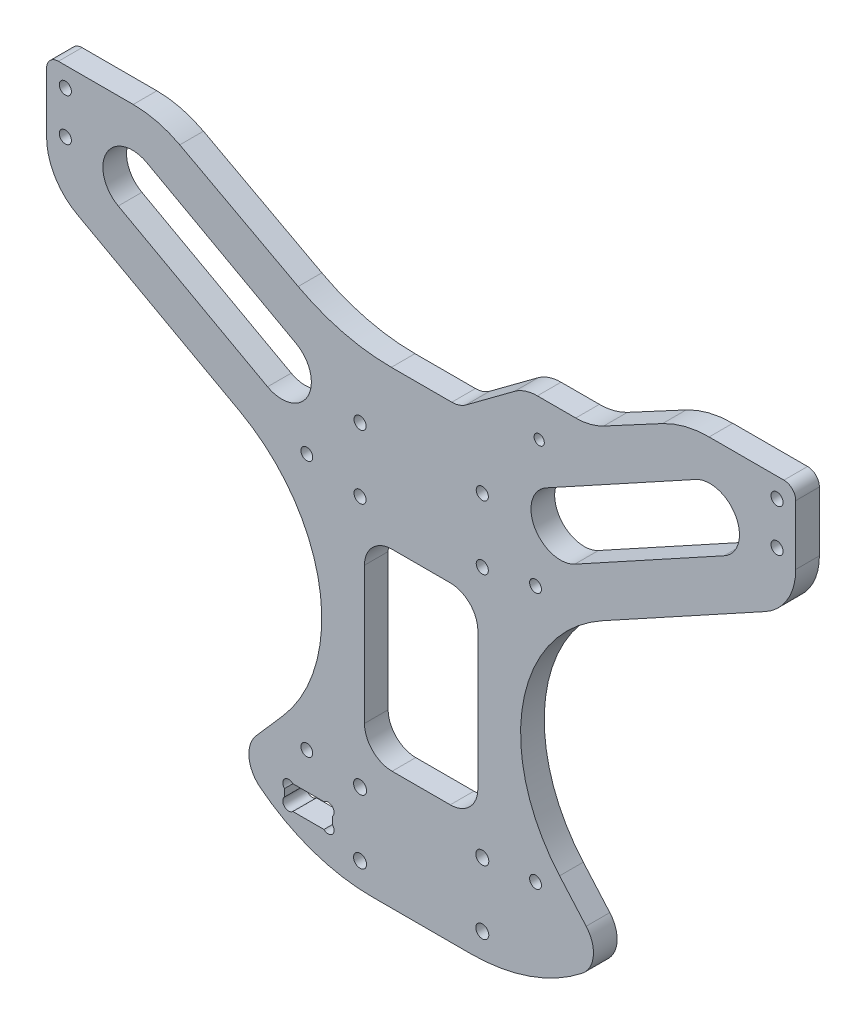
from build123d import *

# Parameters (mm, degrees)
SKETCH1_R                   = 2.6
BOSS_EXTRUDE1_DEPTH         = 12
CUT_EXTRUDE1_DEPTH          = 345.8191555
SKETCH3_W                   = 57.5
SKETCH3_H                   = 97.5
CUT_EXTRUDE2_DEPTH          = 345.8191555
CUT_EXTRUDE3_DEPTH          = 345.8191555
CUT_EXTRUDE4_DEPTH          = 345.8191555
CUT_EXTRUDE5_DEPTH          = 345.8191555
SKETCH7_W                   = 10
SKETCH7_H                   = 11.5
CUT_EXTRUDE6_DEPTH          = 7
SKETCH8_W                   = 10
SKETCH8_H                   = 11.5
CUT_EXTRUDE7_DEPTH          = 7
SKETCH9_W                   = 10
SKETCH9_H                   = 11.5
CUT_EXTRUDE8_DEPTH          = 7
SKETCH10_W                  = 10
SKETCH10_H                  = 11.5
CUT_EXTRUDE9_DEPTH          = 7
SKETCH11_W                  = 10
SKETCH11_H                  = 11.5
CUT_EXTRUDE10_DEPTH         = 7
SKETCH12_W                  = 10
SKETCH12_H                  = 11.5
CUT_EXTRUDE11_DEPTH         = 7
SKETCH13_W                  = 10
SKETCH13_H                  = 11.5
CUT_EXTRUDE12_DEPTH         = 7
SKETCH14_W                  = 10
SKETCH14_H                  = 11.5
CUT_EXTRUDE13_DEPTH         = 7
SKETCH15_W                  = 10
SKETCH15_H                  = 11.5
CUT_EXTRUDE14_DEPTH         = 7
SKETCH16_W                  = 10
SKETCH16_H                  = 11.5
CUT_EXTRUDE15_DEPTH         = 7
SKETCH17_W                  = 10
SKETCH17_H                  = 11.5
CUT_EXTRUDE16_DEPTH         = 7
SKETCH18_W                  = 10
SKETCH18_H                  = 11.5
CUT_EXTRUDE17_DEPTH         = 7
F_12_CLEARANCE_HOLE1_D      = 6
F_12_CLEARANCE_HOLE2_D      = 6.15
F_12_CLEARANCE_HOLE2_DEPTH  = 12
F_1_4_CLEARANCE_HOLE1_D     = 6.6
F_1_4_CLEARANCE_HOLE1_DEPTH = 12
FILLET1_R                   = 3
FILLET2_R                   = 6
FILLET3_R                   = 12
FILLET4_R                   = 14
FILLET5_R                   = 15
FILLET6_R                   = 19.5
FILLET7_R                   = 30
FILLET8_R                   = 50
FILLET9_R                   = 100
CUT_EXTRUDE18_DEPTH         = 5


with BuildPart() as part:
    # Sketch1 → Boss-Extrude1 (new body)
    with BuildSketch(Plane(origin=(0, 0, 0), x_dir=(-1, 0, 0), z_dir=(0, 0, -1))):
        with BuildLine():
            Line((190, 233.5), (190, 287.5))
            Line((190, 287.5), (-190, 287.5))
            Line((-190, 287.5), (-190, 233.5))
            Line((-190, 233.5), (-91.996080671, 179.733208693))
            ThreePointArc((-91.996080671, 179.733208693), (-51.65153849, 123.480878435), (-70.214934772, 56.791995839))
            Line((-70.214934772, 56.791995839), (-93.161541916, 30.540237585))
            ThreePointArc((-93.161541916, 30.540237585), (-62.345354156, 7.98402536), (-25, 0))
            Line((-25, 0), (25, 0))
            ThreePointArc((25, 0), (62.345354156, 7.98402536), (93.161541916, 30.540237585))
            Line((93.161541916, 30.540237585), (70.214934772, 56.791995839))
            ThreePointArc((70.214934772, 56.791995839), (51.65153849, 123.480878435), (91.996080671, 179.733208693))
            Line((91.996080671, 179.733208693), (190, 233.5))
        make_face()
        with Locations((-59.857743265, 243.186048556)):
            Circle(SKETCH1_R, mode=Mode.SUBTRACT)
    extrude(amount=-BOSS_EXTRUDE1_DEPTH)

    # Sketch2 → Cut-Extrude1 (cut, through all)
    with BuildSketch(Plane.XY.offset(12)):
        Polygon((133.5, 287.5), (-133.5, 287.5), (-40.250394076, 237.5), (19.5, 237.5), (52.5, 262), (85.942700979, 262), align=None)
    extrude(amount=-CUT_EXTRUDE1_DEPTH, mode=Mode.SUBTRACT)

    # Sketch3 → Cut-Extrude2 (cut, through all)
    with BuildSketch(Plane(origin=(0, 0, 0), x_dir=(-1, 0, 0), z_dir=(0, 0, -1))):
        with Locations((0, 109)):
            Rectangle(SKETCH3_W, SKETCH3_H)
    extrude(amount=-CUT_EXTRUDE2_DEPTH, mode=Mode.SUBTRACT)

    # Sketch4 → Cut-Extrude3 (cut, through all)
    with BuildSketch(Plane(origin=(0, 0, 0), x_dir=(-1, 0, 0), z_dir=(0, 0, -1))):
        with BuildLine():
            Line((-153.664023227, 239.106528299), (-77.914831534, 197.549098664))
            ThreePointArc((-77.914831534, 197.549098664), (-57.549098664, 203.485168466), (-63.485168466, 223.850901336))
            Line((-63.485168466, 223.850901336), (-139.234360159, 265.40833097))
            ThreePointArc((-139.234360159, 265.40833097), (-159.600093029, 259.472261168), (-153.664023227, 239.106528299))
        make_face()
    extrude(amount=-CUT_EXTRUDE3_DEPTH, mode=Mode.SUBTRACT)

    # Sketch5 → Cut-Extrude4 (cut, through all)
    with BuildSketch(Plane.XY.offset(12)):
        with BuildLine():
            Line((-63.485168466, 223.850901336), (-139.234360159, 265.40833097))
            ThreePointArc((-139.234360159, 265.40833097), (-159.600093029, 259.472261168), (-153.664023227, 239.106528299))
            Line((-153.664023227, 239.106528299), (-77.914831534, 197.549098664))
            ThreePointArc((-77.914831534, 197.549098664), (-57.549098664, 203.485168466), (-63.485168466, 223.850901336))
        make_face()
    extrude(amount=-CUT_EXTRUDE4_DEPTH, mode=Mode.SUBTRACT)

    # Sketch6 → Cut-Extrude5 (cut, through all)
    with BuildSketch(Plane.XY.offset(12)):
        with BuildLine():
            Line((-65.082359313, 17.4), (-49.317640687, 17.4))
            ThreePointArc((-49.317640687, 17.4), (-45.074999992, 17.400000008), (-45.075000016, 21.642640703))
            Line((-45.075000016, 21.642640703), (-45.075000016, 25.357359313))
            ThreePointArc((-45.075000016, 25.357359313), (-45.075000008, 29.599999992), (-49.317640687, 29.6))
            Line((-49.317640687, 29.6), (-65.082359313, 29.6))
            ThreePointArc((-65.082359313, 29.6), (-69.325, 29.6), (-69.325, 25.357359313))
            Line((-69.325, 25.357359313), (-69.325, 21.642640687))
            ThreePointArc((-69.325, 21.642640687), (-69.325, 17.4), (-65.082359313, 17.4))
        make_face()
    extrude(amount=-CUT_EXTRUDE5_DEPTH, mode=Mode.SUBTRACT)

    # Sketch7 → Cut-Extrude6 (cut)
    with BuildSketch(Plane(origin=(0, 0, 0), x_dir=(-1, 0, 0), z_dir=(0, 0, -1))):
        with Locations((31, 45.2)):
            Rectangle(SKETCH7_W, SKETCH7_H)
    extrude(amount=-CUT_EXTRUDE6_DEPTH, mode=Mode.SUBTRACT)

    # Sketch8 → Cut-Extrude7 (cut)
    with BuildSketch(Plane(origin=(0, 0, 0), x_dir=(-1, 0, 0), z_dir=(0, 0, -1))):
        with Locations((-31, 45.2)):
            Rectangle(SKETCH8_W, SKETCH8_H)
    extrude(amount=-CUT_EXTRUDE7_DEPTH, mode=Mode.SUBTRACT)

    # Sketch9 → Cut-Extrude8 (cut)
    with BuildSketch(Plane(origin=(0, 0, 0), x_dir=(-1, 0, 0), z_dir=(0, 0, -1))):
        with Locations((-31, 12.8)):
            Rectangle(SKETCH9_W, SKETCH9_H)
    extrude(amount=-CUT_EXTRUDE8_DEPTH, mode=Mode.SUBTRACT)

    # Sketch10 → Cut-Extrude9 (cut)
    with BuildSketch(Plane(origin=(0, 0, 0), x_dir=(-1, 0, 0), z_dir=(0, 0, -1))):
        with Locations((31, 12.8)):
            Rectangle(SKETCH10_W, SKETCH10_H)
    extrude(amount=-CUT_EXTRUDE9_DEPTH, mode=Mode.SUBTRACT)

    # Sketch11 → Cut-Extrude10 (cut)
    with BuildSketch(Plane(origin=(0, 0, 0), x_dir=(-1, 0, 0), z_dir=(0, 0, -1))):
        with Locations((-31, 172.8)):
            Rectangle(SKETCH11_W, SKETCH11_H)
    extrude(amount=-CUT_EXTRUDE10_DEPTH, mode=Mode.SUBTRACT)

    # Sketch12 → Cut-Extrude11 (cut)
    with BuildSketch(Plane(origin=(0, 0, 0), x_dir=(-1, 0, 0), z_dir=(0, 0, -1))):
        with Locations((31, 205.2)):
            Rectangle(SKETCH12_W, SKETCH12_H)
    extrude(amount=-CUT_EXTRUDE11_DEPTH, mode=Mode.SUBTRACT)

    # Sketch13 → Cut-Extrude12 (cut)
    with BuildSketch(Plane(origin=(0, 0, 0), x_dir=(-1, 0, 0), z_dir=(0, 0, -1))):
        with Locations((31, 172.8)):
            Rectangle(SKETCH13_W, SKETCH13_H)
    extrude(amount=-CUT_EXTRUDE12_DEPTH, mode=Mode.SUBTRACT)

    # Sketch14 → Cut-Extrude13 (cut)
    with BuildSketch(Plane(origin=(0, 0, 0), x_dir=(-1, 0, 0), z_dir=(0, 0, -1))):
        with Locations((-31, 205.2)):
            Rectangle(SKETCH14_W, SKETCH14_H)
    extrude(amount=-CUT_EXTRUDE13_DEPTH, mode=Mode.SUBTRACT)

    # Sketch15 → Cut-Extrude14 (cut)
    with BuildSketch(Plane(origin=(0, 0, 0), x_dir=(-1, 0, 0), z_dir=(0, 0, -1))):
        with Locations((-180.5, 256)):
            Rectangle(SKETCH15_W, SKETCH15_H)
    extrude(amount=-CUT_EXTRUDE14_DEPTH, mode=Mode.SUBTRACT)

    # Sketch16 → Cut-Extrude15 (cut)
    with BuildSketch(Plane(origin=(0, 0, 0), x_dir=(-1, 0, 0), z_dir=(0, 0, -1))):
        with Locations((180.5, 277.5)):
            Rectangle(SKETCH16_W, SKETCH16_H)
    extrude(amount=-CUT_EXTRUDE15_DEPTH, mode=Mode.SUBTRACT)

    # Sketch17 → Cut-Extrude16 (cut)
    with BuildSketch(Plane(origin=(0, 0, 0), x_dir=(-1, 0, 0), z_dir=(0, 0, -1))):
        with Locations((180.5, 256)):
            Rectangle(SKETCH17_W, SKETCH17_H)
    extrude(amount=-CUT_EXTRUDE16_DEPTH, mode=Mode.SUBTRACT)

    # Sketch18 → Cut-Extrude17 (cut)
    with BuildSketch(Plane(origin=(0, 0, 0), x_dir=(-1, 0, 0), z_dir=(0, 0, -1))):
        with Locations((-180.5, 277.5)):
            Rectangle(SKETCH18_W, SKETCH18_H)
    extrude(amount=-CUT_EXTRUDE17_DEPTH, mode=Mode.SUBTRACT)

    # #12 Clearance Hole1 (through all)
    with Locations(Plane.XY.offset(12)):
        with Locations((58, 48), (-58, 178), (58, 178), (-58, 48)):
            Hole(F_12_CLEARANCE_HOLE1_D / 2)

    # #12 Clearance Hole2
    with Locations(Plane.XY.offset(12)):
        with Locations((31, 172.8), (-31, 205.2), (-31, 172.8), (31, 205.2), (180.5, 256), (-180.5, 277.5), (-180.5, 256), (180.5, 277.5)):
            Hole(F_12_CLEARANCE_HOLE2_D / 2, depth=F_12_CLEARANCE_HOLE2_DEPTH)

    # 1/4 Clearance Hole1
    with Locations(Plane.XY.offset(12)):
        with Locations((-31, 45.2), (31, 45.2), (31, 12.8), (-31, 12.8)):
            Hole(F_1_4_CLEARANCE_HOLE1_D / 2, depth=F_1_4_CLEARANCE_HOLE1_DEPTH)

    # Fillet1
    fillet1_edges = [part.edges().sort_by_distance(p)[0] for p in [
        (-26, 39.45, 3.5),
        (-26, 50.95, 3.5),
        (-36, 50.95, 3.5),
        (-36, 39.45, 3.5),
        (36, 50.95, 3.5),
        (26, 50.95, 3.5),
        (26, 39.45, 3.5),
        (36, 39.45, 3.5),
        (36, 7.05, 3.5),
        (36, 18.55, 3.5),
        (26, 18.55, 3.5),
        (26, 7.05, 3.5),
        (-26, 7.05, 3.5),
        (-26, 18.55, 3.5),
        (-36, 18.55, 3.5),
        (-36, 7.05, 3.5),
        (26, 178.55, 3.5),
        (26, 167.05, 3.5),
        (36, 167.05, 3.5),
        (36, 178.55, 3.5),
        (-26, 210.95, 3.5),
        (-36, 210.95, 3.5),
        (-36, 199.45, 3.5),
        (-26, 199.45, 3.5),
        (-26, 167.05, 3.5),
        (-26, 178.55, 3.5),
        (-36, 178.55, 3.5),
        (-36, 167.05, 3.5),
        (26, 210.95, 3.5),
        (26, 199.45, 3.5),
        (36, 199.45, 3.5),
        (36, 210.95, 3.5),
        (175.5, 261.75, 3.5),
        (175.5, 250.25, 3.5),
        (185.5, 250.25, 3.5),
        (185.5, 261.75, 3.5),
        (-175.5, 271.75, 3.5),
        (-175.5, 283.25, 3.5),
        (-185.5, 283.25, 3.5),
        (-185.5, 271.75, 3.5),
        (-175.5, 261.75, 3.5),
        (-185.5, 261.75, 3.5),
        (-185.5, 250.25, 3.5),
        (-175.5, 250.25, 3.5),
        (175.5, 283.25, 3.5),
        (175.5, 271.75, 3.5),
        (185.5, 271.75, 3.5),
        (185.5, 283.25, 3.5),
    ]]
    fillet(fillet1_edges, radius=FILLET1_R)

    # Fillet2
    fillet2_edges = [part.edges().sort_by_distance(p)[0] for p in [
        (190, 287.5, 6),
        (-190, 287.5, 6),
    ]]
    fillet(fillet2_edges, radius=FILLET2_R)

    # Fillet3
    fillet3_edges = [part.edges().sort_by_distance(p)[0] for p in [
        (19.5, 237.5, 6),
    ]]
    fillet(fillet3_edges, radius=FILLET3_R)

    # Fillet4
    fillet4_edges = [part.edges().sort_by_distance(p)[0] for p in [
        (-28.75, 60.25, 6),
        (28.75, 60.25, 6),
        (28.75, 157.75, 6),
        (-28.75, 157.75, 6),
    ]]
    fillet(fillet4_edges, radius=FILLET4_R)

    # Fillet5
    fillet5_edges = [part.edges().sort_by_distance(p)[0] for p in [
        (-93.161541916, 30.540237585, 6),
        (93.161541916, 30.540237585, 6),
    ]]
    fillet(fillet5_edges, radius=FILLET5_R)

    # Fillet6
    fillet6_edges = [part.edges().sort_by_distance(p)[0] for p in [
        (52.5, 262, 6),
    ]]
    fillet(fillet6_edges, radius=FILLET6_R)

    # Fillet7
    fillet7_edges = [part.edges().sort_by_distance(p)[0] for p in [
        (190, 233.5, 6),
        (-190, 233.5, 6),
        (85.942700979, 262, 6),
    ]]
    fillet(fillet7_edges, radius=FILLET7_R)

    # Fillet8
    fillet8_edges = [part.edges().sort_by_distance(p)[0] for p in [
        (133.5, 287.5, 6),
        (-133.5, 287.5, 6),
    ]]
    fillet(fillet8_edges, radius=FILLET8_R)

    # Fillet9
    fillet9_edges = [part.edges().sort_by_distance(p)[0] for p in [
        (-40.250394076, 237.5, 6),
    ]]
    fillet(fillet9_edges, radius=FILLET9_R)

    # Sketch25 → Cut-Extrude18 (cut)
    with BuildSketch(Plane(origin=(0, 0, 0), x_dir=(-1, 0, 0), z_dir=(0, 0, -1))):
        with BuildLine():
            Line((-60.957743265, 238.186048556), (-58.757743265, 238.186048556))
            ThreePointArc((-58.757743265, 238.186048556), (-56.636422921, 239.064728212), (-55.757743265, 241.186048556))
            Line((-55.757743265, 241.186048556), (-55.757743265, 245.186048556))
            ThreePointArc((-55.757743265, 245.186048556), (-56.636422921, 247.307368899), (-58.757743265, 248.186048556))
            Line((-58.757743265, 248.186048556), (-60.957743265, 248.186048556))
            ThreePointArc((-60.957743265, 248.186048556), (-63.079063608, 247.307368899), (-63.957743265, 245.186048556))
            Line((-63.957743265, 245.186048556), (-63.957743265, 241.186048556))
            ThreePointArc((-63.957743265, 241.186048556), (-63.079063608, 239.064728212), (-60.957743265, 238.186048556))
        make_face()
    extrude(amount=-CUT_EXTRUDE18_DEPTH, mode=Mode.SUBTRACT)


solid = part.part
